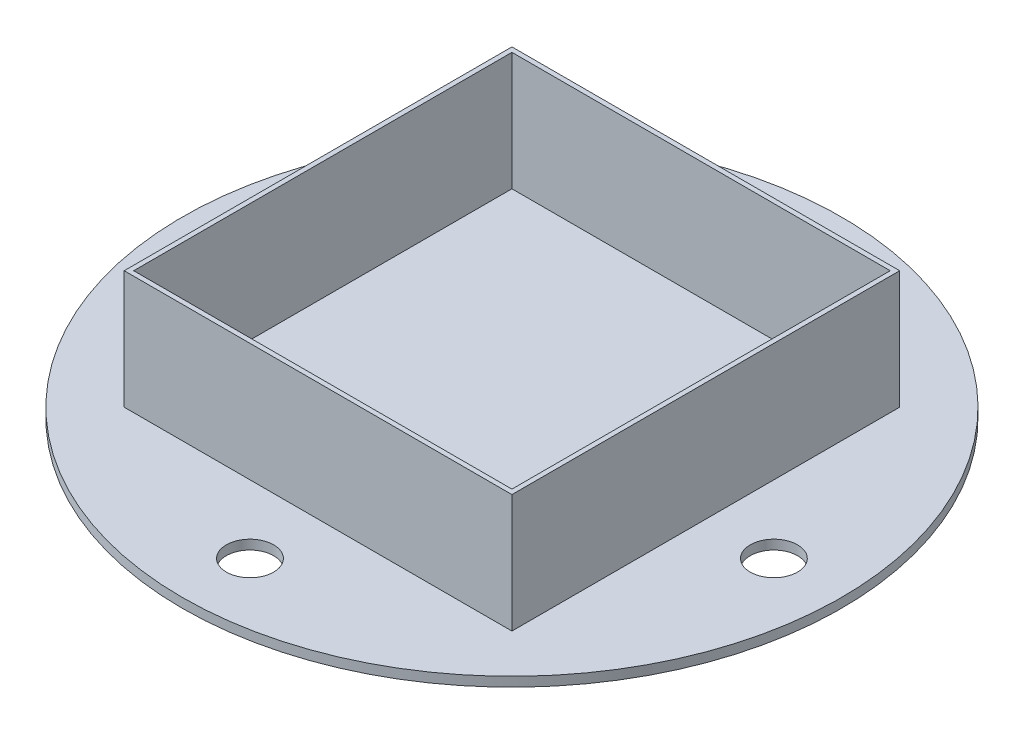
from build123d import *

# Parameters (mm, degrees)
SKETCH1_R           = 88.519
BOSS_EXTRUDE1_DEPTH = 2.54
SKETCH3_W           = 104.14
SKETCH3_H           = 104.14
SKETCH3_W_2         = 101.6
SKETCH3_H_2         = 101.6
BOSS_EXTRUDE2_DEPTH = 31.75
SKETCH4_R           = 6.35
CUT_EXTRUDE1_DEPTH  = 130.148322568


with BuildPart() as part:
    # Sketch1 → Boss-Extrude1 (new body)
    with BuildSketch(Plane(origin=(0, 0, 0), x_dir=(1, 0, 0), z_dir=(0, 1, 0))):
        with Locations(Location((0, 0, 0), (0, 0, 270))):
            Circle(SKETCH1_R)
    extrude(amount=BOSS_EXTRUDE1_DEPTH)

    # Sketch3 → Boss-Extrude2 (add)
    with BuildSketch(Plane(origin=(0, 2.54, 0), x_dir=(1, 0, 0), z_dir=(0, 1, 0))):
        Rectangle(SKETCH3_W, SKETCH3_H)
        Rectangle(SKETCH3_W_2, SKETCH3_H_2, mode=Mode.SUBTRACT)
    extrude(amount=BOSS_EXTRUDE2_DEPTH)

    # Sketch4 → Cut-Extrude1 (cut, through all)
    with BuildSketch(Plane(origin=(0, 2.54, 0), x_dir=(1, 0, 0), z_dir=(0, 1, 0))):
        with Locations(Location((0, 70.4215, 0), (0, 0, 270))):
            Circle(SKETCH4_R)
        with Locations(Location((0, -70.358, 0), (0, 0, 270))):
            Circle(SKETCH4_R)
        with Locations(Location((70.358, 0, 0), (0, 0, 270))):
            Circle(SKETCH4_R)
        with Locations(Location((-70.358, 0, 0), (0, 0, 270))):
            Circle(SKETCH4_R)
    extrude(amount=-CUT_EXTRUDE1_DEPTH, mode=Mode.SUBTRACT)


solid = part.part
